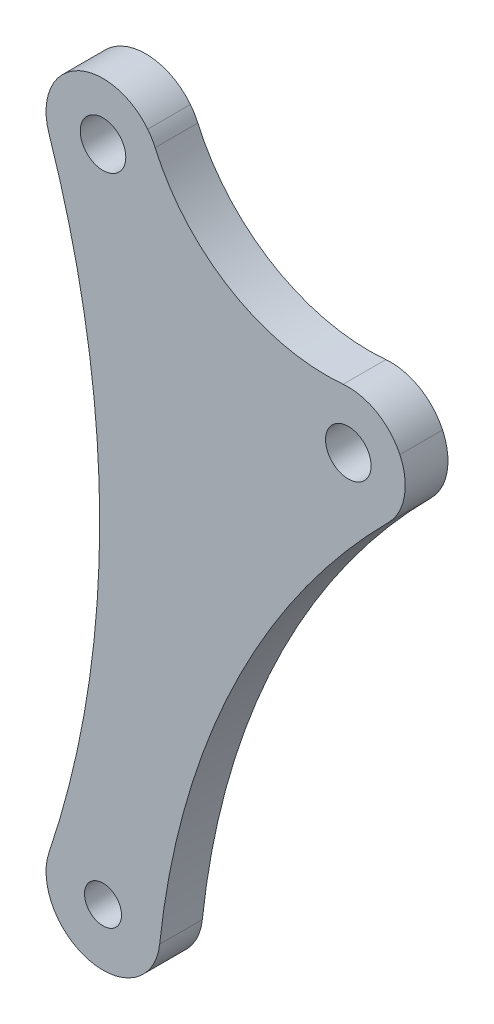
from build123d import *

# Parameters (mm, degrees)
SKETCH_1_R          = 1.35
SKETCH_1_R_2        = 1.3
EXTRUDE_1_DEPTH     = 3
SKETCH_2_R          = 1.6
CUT_EXTRUDE_1_DEPTH = 40.58429055


with BuildPart() as part:
    # 草图1 → 凸台-拉伸1 (new body)
    with BuildSketch(Plane(origin=(0, 0, 0), x_dir=(-1, 0, 0), z_dir=(0, 0, -1))):
        with BuildLine():
            Line((3.311115848, 16.021732214), (3.313115848, 16.021732214))
            ThreePointArc((3.313115848, 16.021732214), (1.422584465, 20.809546819), (-3.619383376, 19.772320768))
            ThreePointArc((-3.619383376, 19.772320768), (-3.907451025, 19.356483629), (-4.140741668, 18.907619539))
            ThreePointArc((-4.140741668, 18.907619539), (-9.493299368, 12.888445888), (-17.351741668, 11.120619539))
            ThreePointArc((-17.351741668, 11.120619539), (-19.703460244, 10.604408599), (-21.333741668, 8.832619539))
            ThreePointArc((-21.333741668, 8.832619539), (-21.651545732, 6.446374123), (-20.542741668, 4.309619539))
            ThreePointArc((-20.542741668, 4.309619539), (-9.614805592, -11.161234041), (-4.459741668, -29.387380461))
            ThreePointArc((-4.459741668, -29.387380461), (-3.626617209, -31.434284825), (-1.833741668, -32.726380461))
            ThreePointArc((-1.833741668, -32.726380461), (0.370527809, -32.871130249), (2.315258332, -31.823380461))
            ThreePointArc((2.315258332, -31.823380461), (3.407459975, -29.901725556), (3.313258332, -27.693380461))
            ThreePointArc((3.313258332, -27.693380461), (-0.247316641, -5.861423686), (3.295002421, 15.973502613))
            Line((3.295002421, 15.973502613), (3.311115848, 16.021732214))
        make_face()
        with Locations(Location((-17.711384152, 7.136232214, 0), (0, 0, 180))):
            Circle(SKETCH_1_R, mode=Mode.SUBTRACT)
        with Locations(Location((-0.480884152, -28.962767786, 0), (0, 0, 180))):
            Circle(SKETCH_1_R_2, mode=Mode.SUBTRACT)
        with Locations(Location((-0.480884152, 17.291232214, 0), (0, 0, 180))):
            Circle(SKETCH_1_R_2, mode=Mode.SUBTRACT)
    extrude(amount=-EXTRUDE_1_DEPTH)

    # 草图2 → 切除-拉伸1 (cut, through all)
    with BuildSketch(Plane.XY.offset(3)):
        with Locations((0.480884152, 17.291232214)):
            Circle(SKETCH_2_R)
        with Locations((17.711384152, 7.136232214)):
            Circle(SKETCH_2_R)
    extrude(amount=-CUT_EXTRUDE_1_DEPTH, mode=Mode.SUBTRACT)


solid = part.part
